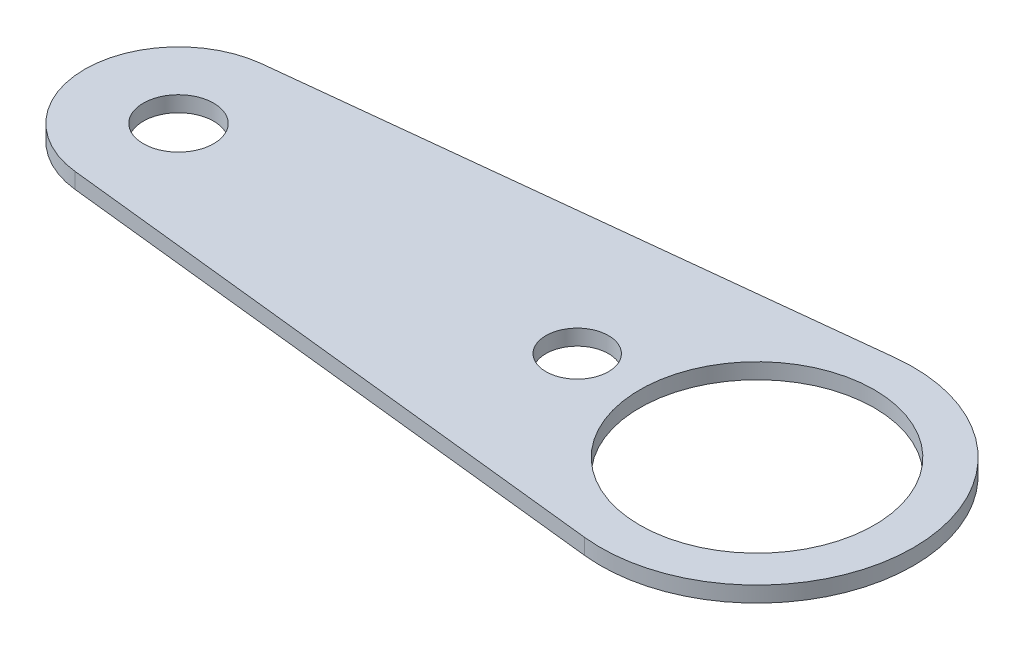
from build123d import *

# Parameters (mm, degrees)
SKETCH1_R           = 2.25
SKETCH1_R_2         = 7.5
SKETCH1_R_3         = 2
BOSS_EXTRUDE1_DEPTH = 1


with BuildPart() as part:
    # Sketch1 → Boss-Extrude1 (new body)
    with BuildSketch(Plane(origin=(0, 0, 0), x_dir=(1, 0, 0), z_dir=(0, 1, 0))):
        with BuildLine():
            Line((-1.081081081, 9.941391437), (-37.648648649, 5.964834862))
            ThreePointArc((-37.648648649, 5.964834862), (-43, 0), (-37.648648649, -5.964834862))
            Line((-37.648648649, -5.964834862), (-1.081081081, -9.941391437))
            ThreePointArc((-1.081081081, -9.941391437), (10, 0), (-1.081081081, 9.941391437))
        make_face()
        with Locations(Location((-37, 0, 0), (0, 0, 270))):
            Circle(SKETCH1_R, mode=Mode.SUBTRACT)
        with Locations(Location((0, 0, 0), (0, 0, 270))):
            Circle(SKETCH1_R_2, mode=Mode.SUBTRACT)
        with Locations(Location((-11.5, 0, 0), (0, 0, 270))):
            Circle(SKETCH1_R_3, mode=Mode.SUBTRACT)
    extrude(amount=BOSS_EXTRUDE1_DEPTH)


solid = part.part
